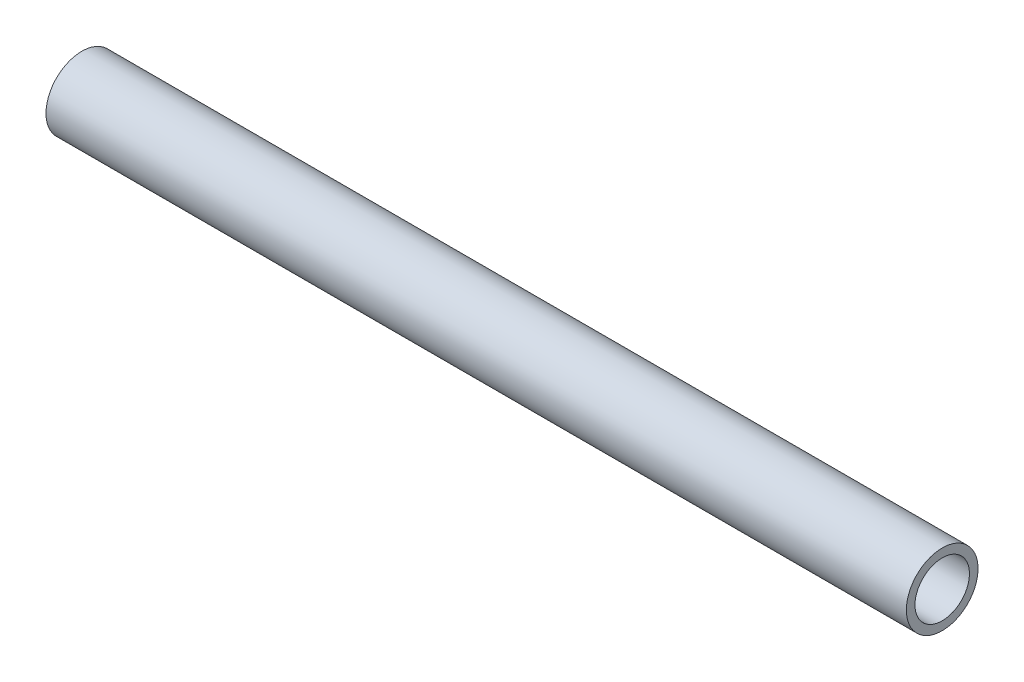
from build123d import *

# Parameters (mm, degrees)
SKETCH1_R           = 12.7
SKETCH1_R_2         = 9.652
BOSS_EXTRUDE1_DEPTH = 304.8


with BuildPart() as part:
    # Sketch1 → Boss-Extrude1 (new body)
    with BuildSketch(Plane(origin=(0, 0, 0), x_dir=(0, 0, -1), z_dir=(1, 0, 0))):
        with Locations(Location((0, 0, 0), (0, 0, 180))):
            Circle(SKETCH1_R)
        with Locations(Location((0, 0, 0), (0, 0, 180))):
            Circle(SKETCH1_R_2, mode=Mode.SUBTRACT)
    extrude(amount=BOSS_EXTRUDE1_DEPTH)


solid = part.part
